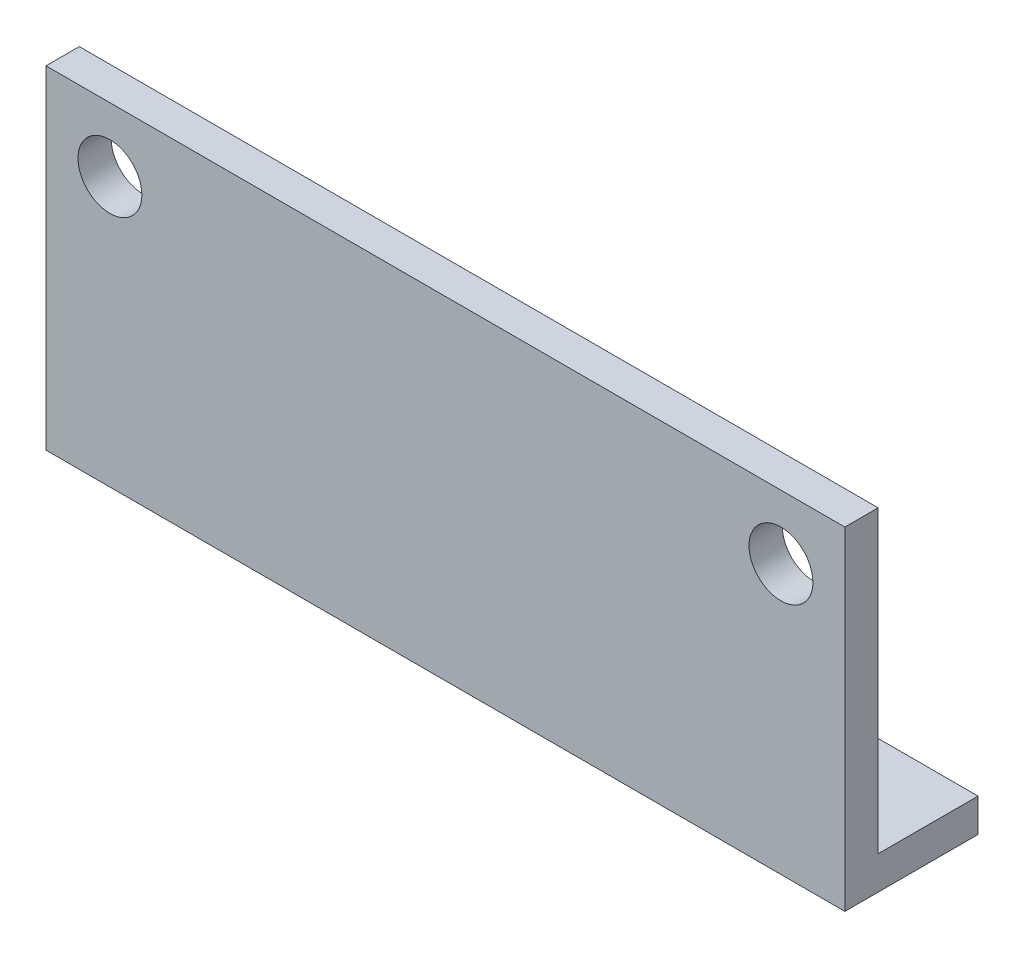
from build123d import *

# Parameters (mm, degrees)
BOSS_EXTRUDE2_DEPTH = 0.15
BOSS_EXTRUDE3_DEPTH = 0.00625
CUT_EXTRUDE2_REACH  = 2.202
SKETCH7_R           = 0.012
SCALE1_SCALE        = 1000


with BuildPart() as part:
    # Sketch4 → Boss-Extrude2 (new, symmetric)
    with BuildSketch(Plane(origin=(0, 0, 0), x_dir=(0, 0, -1), z_dir=(1, 0, 0))):
        Polygon((0, 0), (0, 0.125), (0.0125, 0.125), (0.0125, 0.0125), (0.05, 0.0125), (0.05, 0), align=None)
    extrude(amount=BOSS_EXTRUDE2_DEPTH, both=True)

    # Sketch6 → Boss-Extrude3 (add, symmetric)
    with BuildSketch(Plane(origin=(0, 0, 0), x_dir=(0, 0, -1), z_dir=(1, 0, 0))):
        Polygon((0.0125, 0.0125), (0.0125, 0.125), (0.05, 0.0125), align=None)
    extrude(amount=BOSS_EXTRUDE3_DEPTH, both=True)

    # Sketch7 → Cut-Extrude2 (cut, up to next)
    with BuildSketch(Plane.XY, mode=Mode.PRIVATE) as cut_extrude2_sk1:
        with Locations((-0.126, 0.101)):
            Circle(SKETCH7_R)
    cut_extrude2_tool1 = extrude(cut_extrude2_sk1.sketch, amount=-CUT_EXTRUDE2_REACH, mode=Mode.PRIVATE) & part.part
    cut_extrude2 = cut_extrude2_tool1.solids().sort_by_distance((-0.126, 0.101, 0))[0]
    add(cut_extrude2, mode=Mode.SUBTRACT)

    # Mirror1: Cut-Extrude2 across plane
    add(cut_extrude2.mirror(Plane(origin=(0, 0, 0), x_dir=(0, 0, 1), z_dir=(1, 0, 0))), mode=Mode.SUBTRACT)


with BuildPart() as part_1:
    # Scale1: scaled about (0, 0, 0)
    add(part.part.scale(SCALE1_SCALE))


solid = part_1.part
